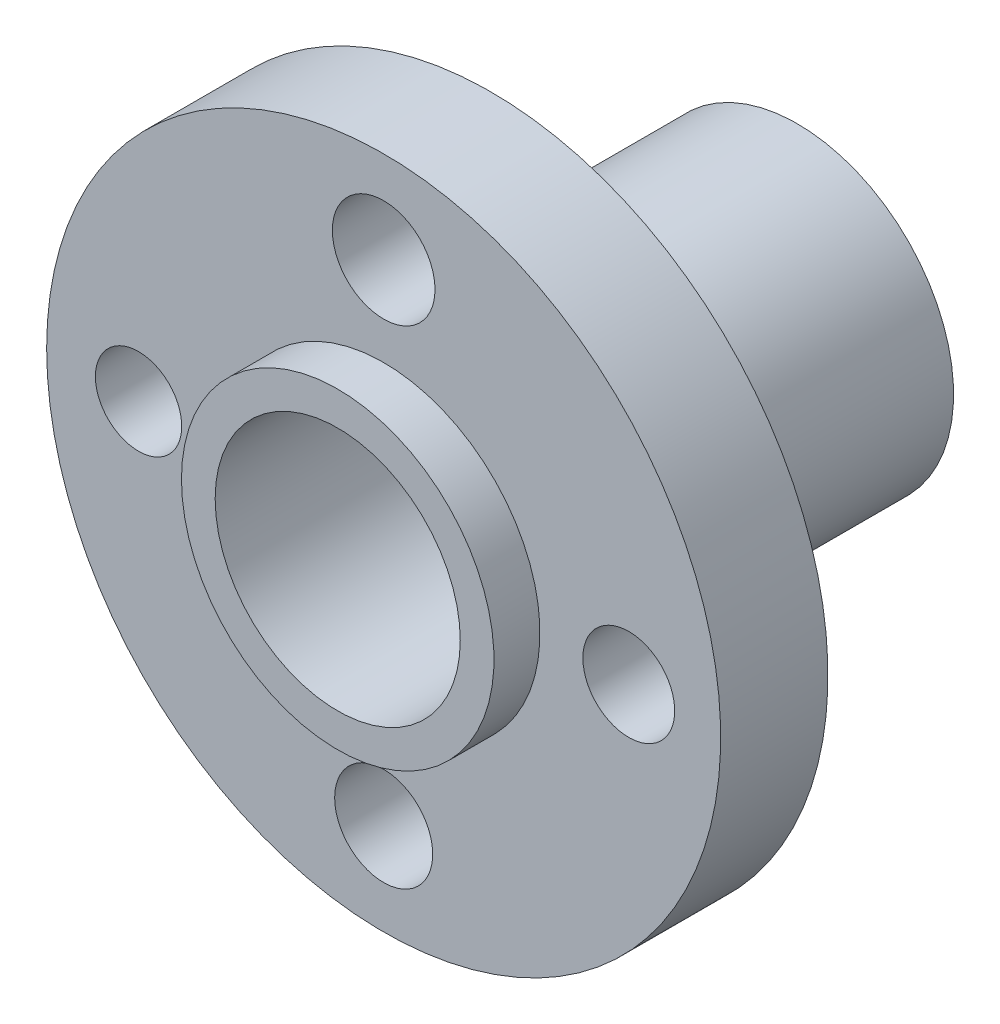
from build123d import *

# Parameters (mm, degrees)
SKETCH2_R          = 4
CUT_EXTRUDE1_DEPTH = 22.610182785
SKETCH3_R          = 1.409137036
SKETCH3_R_2        = 1.6
SKETCH3_R_3        = 1.49849824
SKETCH3_R_4        = 1.674312885
CUT_EXTRUDE2_DEPTH = 19.493242009


with BuildPart() as part:
    # Sketch1 → Revolve1 (revolve)
    with BuildSketch(Plane(origin=(0, 0, 0), x_dir=(1, 0, 0), z_dir=(0, 1, 0)), mode=Mode.PRIVATE) as revolve1_sk:
        Polygon((0, 0), (5.1, 0), (5.1, 1.5), (11, 1.5), (11, 5), (5.1, 5), (5.1, 15), (0, 15), align=None)
    revolve(revolve1_sk.sketch.rotate(Axis((0, 0, -15), (0, 0, 1)), 180), axis=Axis((0, 0, -15), (0, 0, 1)))

    # Sketch2 → Cut-Extrude1 (cut, through all)
    with BuildSketch(Plane(origin=(0, 0, -15), x_dir=(-1, 0, 0), z_dir=(0, 0, -1))):
        Circle(SKETCH2_R)
    extrude(amount=-CUT_EXTRUDE1_DEPTH, mode=Mode.SUBTRACT)

    # Sketch3 → Cut-Extrude2 (cut, through all)
    with BuildSketch(Plane(origin=(0, 0, -5), x_dir=(-1, 0, 0), z_dir=(0, 0, -1))):
        with Locations((8, 0)):
            Circle(SKETCH3_R)
        with Locations((0, -8)):
            Circle(SKETCH3_R_2)
        with Locations((-8, 0)):
            Circle(SKETCH3_R_3)
        with Locations((0, 8)):
            Circle(SKETCH3_R_4)
    extrude(amount=-CUT_EXTRUDE2_DEPTH, mode=Mode.SUBTRACT)


solid = part.part
